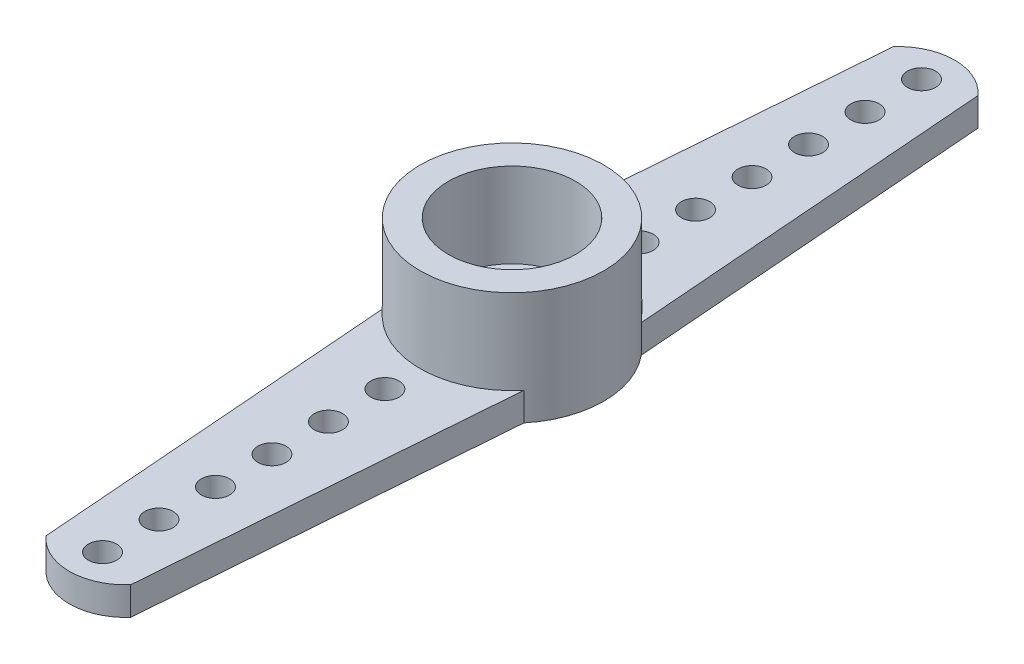
from build123d import *

# Parameters (mm, degrees)
SKETCH_1_R      = 2.25
EXTRUDE_1_DEPTH = 4
SKETCH_1_3_R    = 2.25
EXTRUDE_2_DEPTH = 1
SKETCH_1_4_R    = 0.5
EXTRUDE_3_DEPTH = 1
SKETCH_1_5_R    = 0.5
EXTRUDE_4_DEPTH = 1


with BuildPart() as part:
    # 草图1 → 凸台-拉伸1 (new body)
    with BuildSketch(Plane(origin=(0, 0, 0), x_dir=(1, 0, 0), z_dir=(0, 1, 0))):
        with BuildLine():
            ThreePointArc((2.5, 2.076655966), (0, 3.25), (-2.5, 2.076655966))
            ThreePointArc((-2.5, 2.076655966), (-3.25, 0), (-2.5, -2.076655966))
            ThreePointArc((-2.5, -2.076655966), (0, -3.25), (2.5, -2.076655966))
            ThreePointArc((2.5, -2.076655966), (3.056754815, -1.103970108), (3.25, 0))
            ThreePointArc((3.25, 0), (3.056754815, 1.103970108), (2.5, 2.076655966))
        make_face()
        Circle(SKETCH_1_R, mode=Mode.SUBTRACT)
    extrude(amount=EXTRUDE_1_DEPTH)

    # 草图1<3> → 凸台-拉伸2 (add)
    with BuildSketch(Plane(origin=(0, 0, 0), x_dir=(1, 0, 0), z_dir=(0, 1, 0))):
        Circle(SKETCH_1_3_R)
    extrude(amount=EXTRUDE_2_DEPTH)

    # 草图1<4> → 凸台-拉伸3 (add)
    with BuildSketch(Plane(origin=(0, 0, 0), x_dir=(1, 0, 0), z_dir=(0, 1, 0))):
        with BuildLine():
            ThreePointArc((1.5, 15), (0, 15.677124344), (-1.5, 15))
            Line((-1.5, 15), (-2.5, 2.076655966))
            ThreePointArc((-2.5, 2.076655966), (0, 3.25), (2.5, 2.076655966))
            Line((2.5, 2.076655966), (1.5, 15))
        make_face()
        with Locations((0, 4.5)):
            Circle(SKETCH_1_4_R, mode=Mode.SUBTRACT)
        with Locations((0, 6.5)):
            Circle(SKETCH_1_4_R, mode=Mode.SUBTRACT)
        with Locations((0, 8.5)):
            Circle(SKETCH_1_4_R, mode=Mode.SUBTRACT)
        with Locations((0, 10.5)):
            Circle(SKETCH_1_4_R, mode=Mode.SUBTRACT)
        with Locations((0, 12.5)):
            Circle(SKETCH_1_4_R, mode=Mode.SUBTRACT)
        with Locations((0, 14.5)):
            Circle(SKETCH_1_4_R, mode=Mode.SUBTRACT)
    extrude(amount=EXTRUDE_3_DEPTH)

    # 草图1<5> → 凸台-拉伸4 (add)
    with BuildSketch(Plane(origin=(0, 0, 0), x_dir=(1, 0, 0), z_dir=(0, 1, 0))):
        with BuildLine():
            ThreePointArc((2.5, -2.076655966), (0, -3.25), (-2.5, -2.076655966))
            Line((-2.5, -2.076655966), (-1.5, -15))
            ThreePointArc((-1.5, -15), (0, -15.677124344), (1.5, -15))
            Line((1.5, -15), (2.5, -2.076655966))
        make_face()
        with Locations((0, -14.5)):
            Circle(SKETCH_1_5_R, mode=Mode.SUBTRACT)
        with Locations((0, -12.5)):
            Circle(SKETCH_1_5_R, mode=Mode.SUBTRACT)
        with Locations((0, -10.5)):
            Circle(SKETCH_1_5_R, mode=Mode.SUBTRACT)
        with Locations((0, -8.5)):
            Circle(SKETCH_1_5_R, mode=Mode.SUBTRACT)
        with Locations((0, -6.5)):
            Circle(SKETCH_1_5_R, mode=Mode.SUBTRACT)
        with Locations((0, -4.5)):
            Circle(SKETCH_1_5_R, mode=Mode.SUBTRACT)
    extrude(amount=EXTRUDE_4_DEPTH)


solid = part.part
